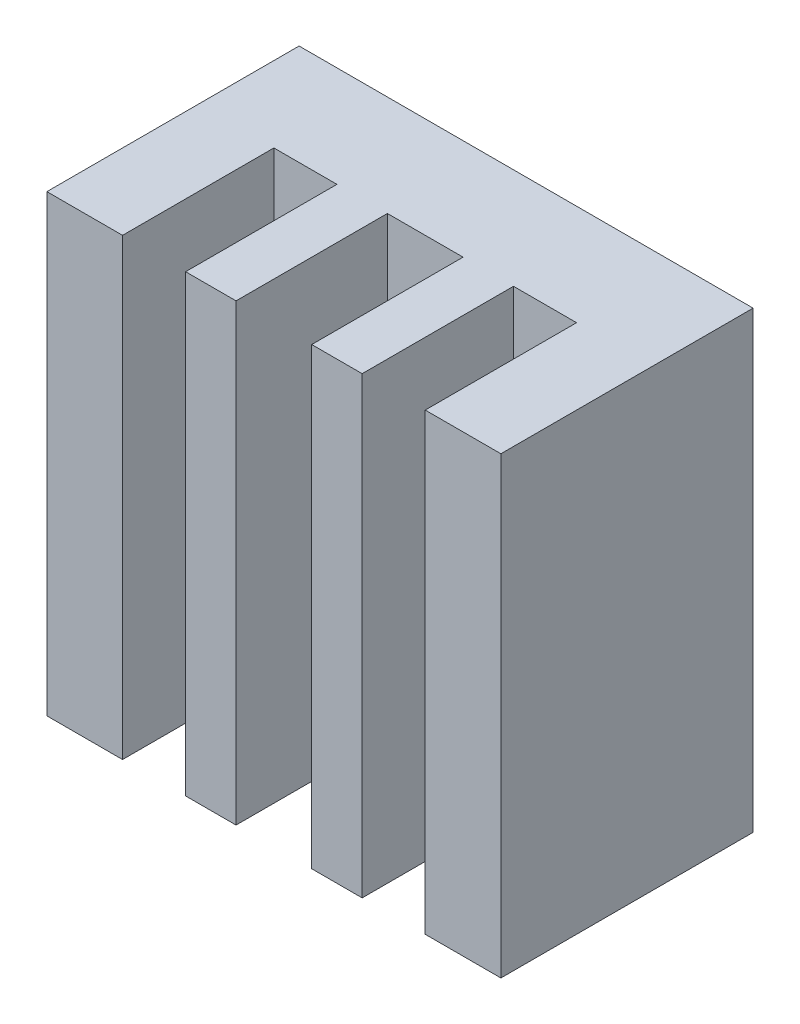
from build123d import *

# Parameters (mm, degrees)
SKETCH_1_W          = 9
SKETCH_1_H          = 9
EXTRUDE_1_DEPTH     = 5
SKETCH_2_W          = 1.25
SKETCH_2_H          = 3
SKETCH_2_W_2        = 0.75
CUT_EXTRUDE_1_DEPTH = 10


with BuildPart() as part:
    # 草图1 → 凸台-拉伸1 (new body)
    with BuildSketch(Plane.XY):
        with Locations((4.5, 4.5)):
            Rectangle(SKETCH_1_W, SKETCH_1_H)
    extrude(amount=EXTRUDE_1_DEPTH)

    # 草图2 → 切除-拉伸1 (cut)
    with BuildSketch(Plane.XZ):
        with Locations((2.125, 3.5)):
            Rectangle(SKETCH_2_W, SKETCH_2_H)
        with Locations((4.125, 3.5)):
            Rectangle(SKETCH_2_W_2, SKETCH_2_H)
        with Locations((4.875, 3.5)):
            Rectangle(SKETCH_2_W_2, SKETCH_2_H)
        with Locations((6.875, 3.5)):
            Rectangle(SKETCH_2_W, SKETCH_2_H)
    extrude(amount=-CUT_EXTRUDE_1_DEPTH, mode=Mode.SUBTRACT)


solid = part.part
